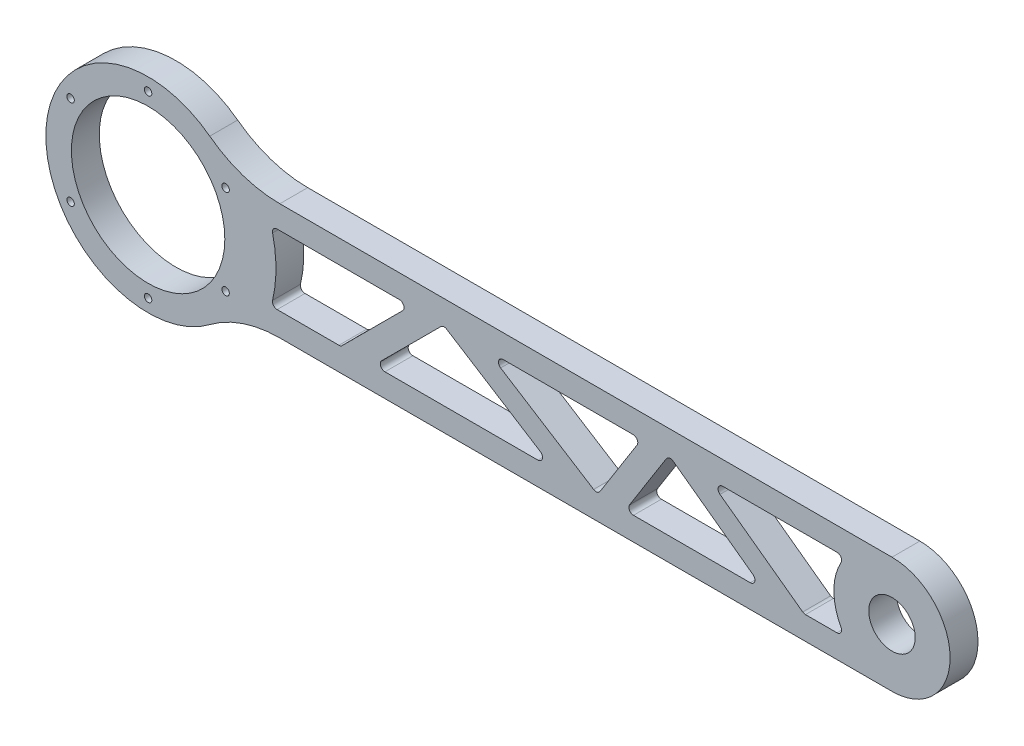
from build123d import *

# Parameters (mm, degrees)
EXTRUDE_1_DEPTH         = 12
SKETCH_5_R              = 33
SKETCH_5_R_2            = 10
CUT_EXTRUDE_1_DEPTH     = 349.001436779
CUT_EXTRUDE_2_DEPTH     = 349.001436779
FILLET_1_R              = 2
HOLE_WIZARD_3_2_3_2_1_D = 3.2


with BuildPart() as part:
    # 草图1 → 凸台-拉伸1 (new body)
    with BuildSketch(Plane.XY):
        with BuildLine():
            Line((320, 25), (56.665686266, 25))
            ThreePointArc((56.665686266, 25), (40.770417333, 27.593877763), (26.524363784, 35.106382979))
            ThreePointArc((26.524363784, 35.106382979), (-44, 0), (26.524363784, -35.106382979))
            ThreePointArc((26.524363784, -35.106382979), (40.770417333, -27.593877763), (56.665686266, -25))
            Line((56.665686266, -25), (320, -25))
            ThreePointArc((320, -25), (345, 0), (320, 25))
        make_face()
    extrude(amount=EXTRUDE_1_DEPTH)

    # 草图5 → 切除-拉伸1 (cut, through all)
    with BuildSketch(Plane.XY.offset(12)):
        Circle(SKETCH_5_R)
        with Locations((320, 0)):
            Circle(SKETCH_5_R_2)
    extrude(amount=-CUT_EXTRUDE_1_DEPTH, mode=Mode.SUBTRACT)

    # 草图6 → 切除-拉伸2 (cut, through all)
    with BuildSketch(Plane.XY.offset(12)):
        with BuildLine():
            Line((112.915026221, 15), (82.915026221, -15))
            Line((82.915026221, -15), (72.915026221, -15))
            Line((72.915026221, -15), (52.915026221, -15))
            ThreePointArc((52.915026221, -15), (55, 0), (52.915026221, 15))
            Line((52.915026221, 15), (112.915026221, 15))
        make_face()
        Polygon((97.057161845, -15), (174.604308358, -15), (127.057161845, 15), align=None)
        Polygon((145.797288554, 15), (212.27301577, 15), (193.344435067, -15), align=None)
        Polygon((205.168568427, -15), (224.097149131, 15), (265.168568427, -15), align=None)
        with BuildLine():
            Line((241.050881866, 15), (282.122301163, -15))
            Line((282.122301163, -15), (300, -15))
            ThreePointArc((300, -15), (295, 0), (300, 15))
            Line((300, 15), (241.050881866, 15))
        make_face()
    extrude(amount=-CUT_EXTRUDE_2_DEPTH, mode=Mode.SUBTRACT)

    # 圆角1
    fillet_1_edges = [part.edges().sort_by_distance(p)[0] for p in [
        (97.057161845, -15, 6),
        (127.057161845, 15, 6),
        (174.604308358, -15, 6),
        (82.915026221, -15, 6),
        (52.915026221, -15, 6),
        (52.915026221, 15, 6),
        (112.915026221, 15, 6),
        (193.344435067, -15, 6),
        (145.797288554, 15, 6),
        (212.27301577, 15, 6),
        (241.050881866, 15, 6),
        (300, 15, 6),
        (300, -15, 6),
        (282.122301163, -15, 6),
        (265.168568427, -15, 6),
        (205.168568427, -15, 6),
        (224.097149131, 15, 6),
    ]]
    fillet(fillet_1_edges, radius=FILLET_1_R)

    # Ø3.2 (3.2) 直径孔1 (through all)
    with Locations(Plane(origin=(0, 38.5, 12), x_dir=(1, 0, 0), z_dir=(0, 0, 1))):
        with Locations((0, 0), (-33.341978046, -19.25), (-33.341978046, -57.75), (0, -77), (33.341978046, -57.75), (33.341978046, -19.25)):
            Hole(HOLE_WIZARD_3_2_3_2_1_D / 2)


solid = part.part
